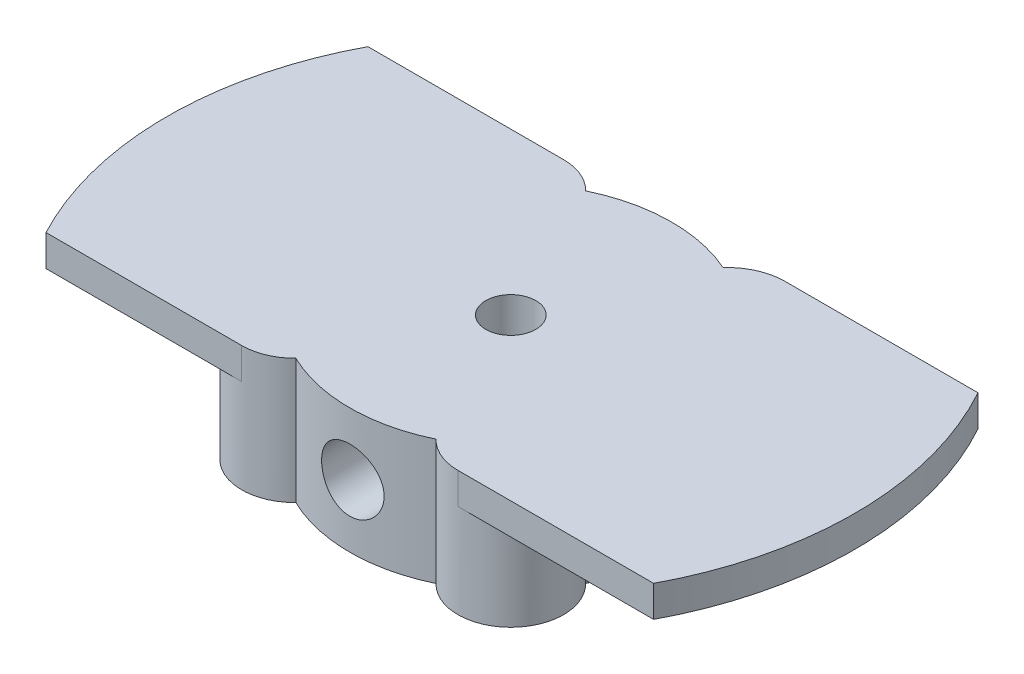
from build123d import *

# Parameters (mm, degrees)
SKETCH1_R           = 1.6
BOSS_EXTRUDE1_DEPTH = 8
SKETCH3_R           = 2
CUT_EXTRUDE1_DEPTH  = 14.5
BOSS_EXTRUDE3_START = -2
BOSS_EXTRUDE3_DEPTH = 2
SKETCH5_R           = 2.25
CUT_EXTRUDE2_DEPTH  = 6.3


with BuildPart() as part:
    # Sketch1 → Boss-Extrude1 (new body)
    with BuildSketch(Plane(origin=(0, 0, 0), x_dir=(1, 0, 0), z_dir=(0, 1, 0))):
        with BuildLine():
            ThreePointArc((-9.272031939, -4.485468061), (-9.308556454, -9.308556454), (-4.485468061, -9.272031939))
            ThreePointArc((-4.485468061, -9.272031939), (0, -10.3), (4.485468061, -9.272031939))
            ThreePointArc((4.485468061, -9.272031939), (9.308556454, -9.308556454), (9.272031939, -4.485468061))
            ThreePointArc((9.272031939, -4.485468061), (10.298455819, -0.178347233), (9.421782939, 4.161731161))
            ThreePointArc((9.421782939, 4.161731161), (9.547911886, 9.547911886), (4.161731161, 9.421782939))
            ThreePointArc((4.161731161, 9.421782939), (-0.178347233, 10.298455819), (-4.485468061, 9.272031939))
            ThreePointArc((-4.485468061, 9.272031939), (-9.308556454, 9.308556454), (-9.272031939, 4.485468061))
            ThreePointArc((-9.272031939, 4.485468061), (-10.3, 0), (-9.272031939, -4.485468061))
        make_face()
        with Locations(Location((0, 0, 0), (0, 0, 270))):
            Circle(SKETCH1_R, mode=Mode.SUBTRACT)
    extrude(amount=BOSS_EXTRUDE1_DEPTH)

    # Sketch3 → Cut-Extrude1 (cut)
    with BuildSketch(Plane.XY):
        with Locations(Location((0, 4, 0), (0, 0, 180))):
            Circle(SKETCH3_R)
    extrude(amount=CUT_EXTRUDE1_DEPTH, mode=Mode.SUBTRACT)

    # Sketch4 → Boss-Extrude3 (add)
    with BuildSketch(Plane(origin=(0, 8, 0), x_dir=(1, 0, 0), z_dir=(0, 1, 0)).offset(BOSS_EXTRUDE3_START)):
        with BuildLine():
            Line((-19.439907407, 10.3), (-6.915, 10.3))
            ThreePointArc((-6.915, 10.3), (-10.052052009, 8.186664144), (-9.272031939, 4.485468061))
            ThreePointArc((-9.272031939, 4.485468061), (-10.3, 0), (-9.272031939, -4.485468061))
            ThreePointArc((-9.272031939, -4.485468061), (-10.052052009, -8.186664144), (-6.915, -10.3))
            Line((-6.915, -10.3), (-19.439907407, -10.3))
            ThreePointArc((-19.439907407, -10.3), (-22, 0), (-19.439907407, 10.3))
        make_face()
        with BuildLine():
            Line((19.256747497, 10.638499698), (6.915, 10.638499698))
            ThreePointArc((6.915, 10.638499698), (10.387480791, 8.25899671), (9.421782939, 4.161731161))
            ThreePointArc((9.421782939, 4.161731161), (10.298455819, -0.178347233), (9.272031939, -4.485468061))
            ThreePointArc((9.272031939, -4.485468061), (10.052052009, -8.186664144), (6.915, -10.3))
            Line((6.915, -10.3), (19.439907407, -10.3))
            ThreePointArc((19.439907407, -10.3), (21.999158338, 0.192438041), (19.256747497, 10.638499698))
        make_face()
    extrude(amount=BOSS_EXTRUDE3_DEPTH)

    # Sketch5 → Cut-Extrude2 (cut)
    with BuildSketch(Plane.XZ):
        with Locations(Location((-6.915, 6.915, 0), (0, 0, 270))):
            Circle(SKETCH5_R)
        with Locations(Location((6.915, 6.915, 0), (0, 0, 270))):
            Circle(SKETCH5_R)
        with Locations(Location((6.915, -6.915, 0), (0, 0, 270))):
            Circle(SKETCH5_R)
        with Locations(Location((-6.915, -6.915, 0), (0, 0, 270))):
            Circle(SKETCH5_R)
    extrude(amount=-CUT_EXTRUDE2_DEPTH, mode=Mode.SUBTRACT)


solid = part.part
